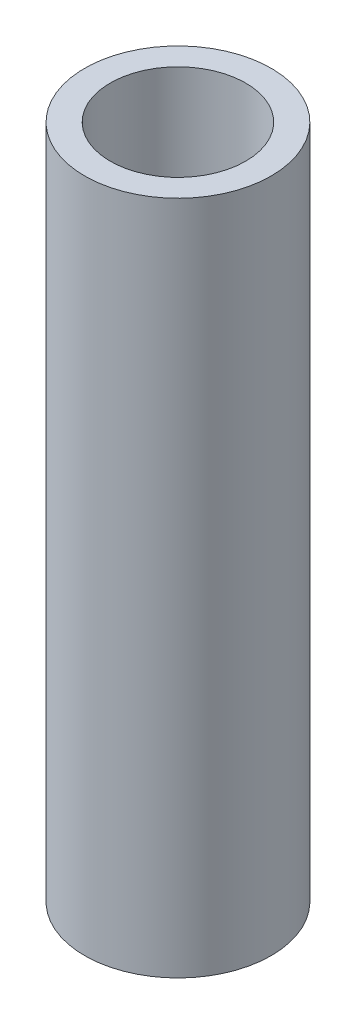
from build123d import *


with BuildPart() as part:
    # Skizze1 → Rotation1 (revolve)
    with BuildSketch(Plane.XY, mode=Mode.PRIVATE) as rotation1_sk:
        Polygon((-3.4, 0), (-3.4, 15), (0, 15), (0, 15.4), (-3.05, 15.4), (-3.05, 30.4), (-4.2, 30.4), (-4.2, 0), align=None)
    revolve(rotation1_sk.sketch.rotate(Axis((0, 0, 0), (0, 1, 0)), 180), axis=Axis((0, 0, 0), (0, 1, 0)))


solid = part.part
